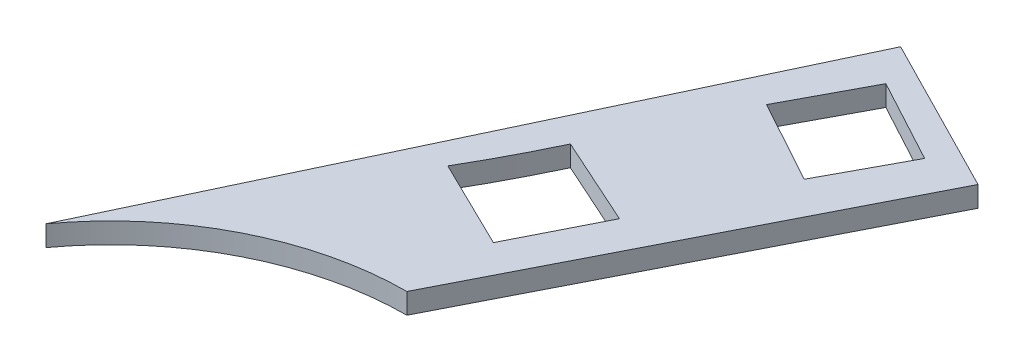
from build123d import *

# Parameters (mm, degrees)
BOSS_EXTRUDE3_DEPTH      = 1
BOSS_EXTRUDE3_DEPTH_BACK = 1.791091685
CUT_EXTRUDE4_DEPTH       = 134.344317451
CUT_EXTRUDE7_DEPTH       = 134.344317451


with BuildPart() as part:
    # Sketch2 → Boss-Extrude3 (new, two sides: drawn at the far end of the back side and taken through both)
    with BuildSketch(Plane(origin=(0, 39.78932127, 0), x_dir=(1, 0, 0), z_dir=(0, 1, 0)).offset(-BOSS_EXTRUDE3_DEPTH_BACK)):
        with BuildLine():
            Line((-62.934827524, 31.1490062), (-36.827019598, 82.334560695))
            Line((-36.827019598, 82.334560695), (-58.206533771, 93.239439133))
            Line((-58.206533771, 93.239439133), (-95.285485747, 14.655800367))
            ThreePointArc((-95.285485747, 14.655800367), (-81.079538231, 26.765253936), (-62.934827524, 31.1490062))
        make_face()
    extrude(amount=BOSS_EXTRUDE3_DEPTH + BOSS_EXTRUDE3_DEPTH_BACK)

    # Sketch14 → Cut-Extrude4 (cut, through all)
    with BuildSketch(Plane(origin=(0, 40.78932127, 0), x_dir=(1, 0, 0), z_dir=(0, 1, 0))):
        Polygon((-60.497453494, 77.385579161), (-49.198590392, 71.186677889), (-43.491580172, 81.777523219), (-54.878158967, 87.916549938), align=None)
    extrude(amount=-CUT_EXTRUDE4_DEPTH, mode=Mode.SUBTRACT)

    # Sketch15 → Cut-Extrude7 (cut, through all)
    with BuildSketch(Plane(origin=(0, 40.78932127, 0), x_dir=(1, 0, 0), z_dir=(0, 1, 0))):
        with BuildLine():
            Line((-69.15808426, 59.503123178), (-57.079111782, 54.0598094))
            Line((-57.079111782, 54.0598094), (-62.805804845, 42.724997947))
            Line((-62.805804845, 42.724997947), (-74.883268234, 48.631494641))
            ThreePointArc((-74.883268234, 48.631494641), (-71.899649138, 54.003573981), (-69.15808426, 59.503123178))
        make_face()
    extrude(amount=-CUT_EXTRUDE7_DEPTH, mode=Mode.SUBTRACT)


solid = part.part
